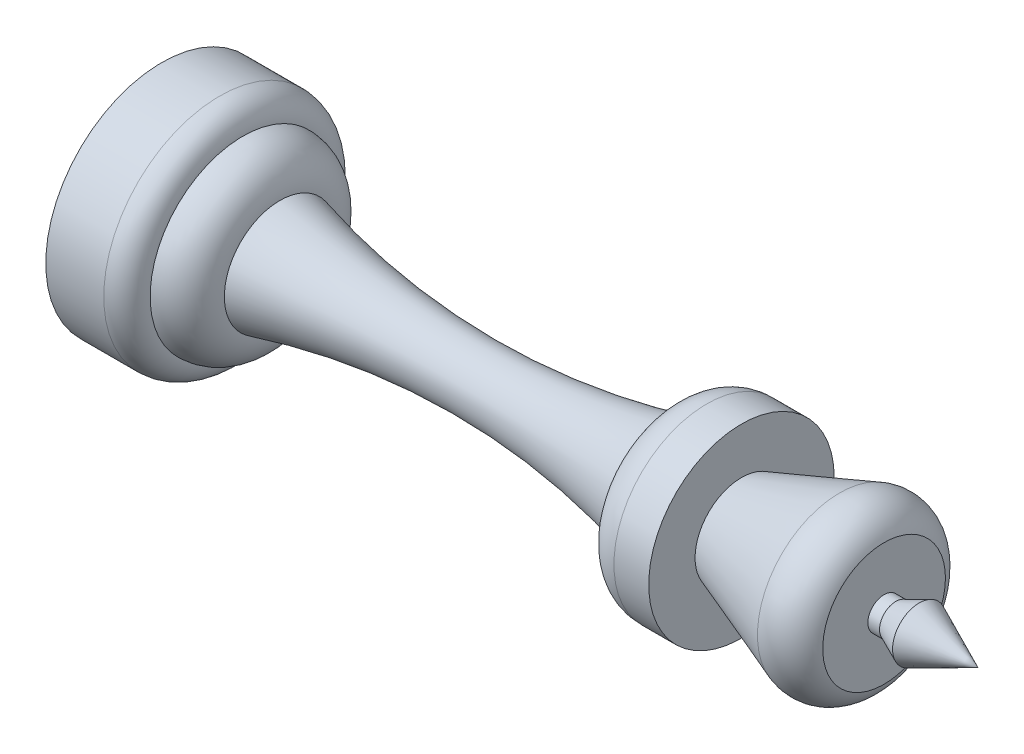
from build123d import *


with BuildPart() as part:
    # Sketch 153 → Повернуть1 (revolve)
    with BuildSketch(Plane(origin=(0, 0, 0), x_dir=(1, 0, 0), z_dir=(0, 1, 0))):
        Polygon((0, 10), (0, 0), (1, 0), (1, 5.25), (3.5, 5.25), (3.5, 0), (5, 0), (5, 10), align=None)
        with BuildLine():
            ThreePointArc((7, 8), (6.414213562, 9.414213562), (5, 10))
            Line((5, 10), (5, 0))
            Line((5, 0), (7, 0))
            Line((7, 0), (7, 8))
        make_face()
        with BuildLine():
            ThreePointArc((10.2, 4.8), (9.2627417, 7.0627417), (7, 8))
            Line((7, 8), (7, 0))
            Line((7, 0), (10.2, 0))
            Line((10.2, 0), (10.2, 4.8))
        make_face()
    revolve(axis=Axis((5, 0, 0), (-1, 0, 0)))

    # Sketch 880 → Повернуть2 (revolve)
    with BuildSketch(Plane(origin=(0, 0, 0), x_dir=(1, 0, 0), z_dir=(0, 1, 0))):
        with BuildLine():
            Line((10.2, 4.8), (10.2, 0))
            Line((10.2, 0), (70.4, 0))
            Line((70.4, 0), (65.331156927, 2.3))
            Line((65.331156927, 2.3), (63.30687842, 1.4))
            Line((63.30687842, 1.4), (62.3, 1.4))
            Line((62.3, 1.4), (62.3, 5.291657255))
            ThreePointArc((62.3, 5.291657255), (60.748015293, 6.979485771), (58.457233587, 7.07818129))
            Line((58.457233587, 7.07818129), (50, 4))
            Line((50, 4), (50, 8))
            Line((50, 8), (47, 8))
            ThreePointArc((47, 8), (44.7372583, 7.0627417), (43.8, 4.8))
            ThreePointArc((43.8, 4.8), (27, 2.591400685), (10.2, 4.8))
        make_face()
    revolve(axis=Axis((50, 0, 0), (-1, 0, 0)))


solid = part.part
